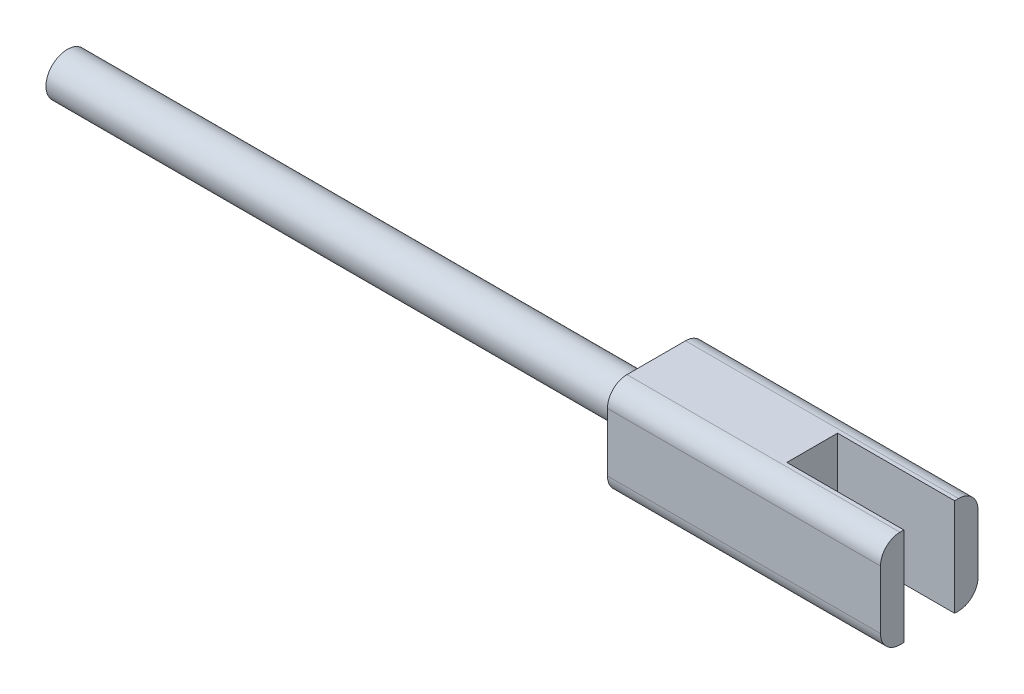
from build123d import *

# Parameters (mm, degrees)
SKETCH1_R               = 1.09
BOSS_EXTRUDE1_DEPTH     = 32.2
BOSS_EXTRUDE2_DEPTH     = 14
CUT_EXTRUDE1_DEPTH      = 45.341177251
CUT_EXTRUDE1_DEPTH_BACK = 45.341177251
SKETCH3_W               = 7
SKETCH3_H               = 2.6


with BuildPart() as part:
    # Sketch1 → Boss-Extrude1 (new body)
    with BuildSketch(Plane(origin=(0, 0, 0), x_dir=(0, 0, -1), z_dir=(1, 0, 0))):
        Circle(SKETCH1_R)
    extrude(amount=BOSS_EXTRUDE1_DEPTH)

    # Sketch2 → Boss-Extrude2 (add)
    with BuildSketch(Plane(origin=(30.2, 0, 0), x_dir=(0, 0, -1), z_dir=(1, 0, 0))):
        with BuildLine():
            Line((-1.5, -2.5), (1.5, -2.5))
            ThreePointArc((1.5, -2.5), (2.207106781, -2.207106781), (2.5, -1.5))
            Line((2.5, -1.5), (2.5, 1.5))
            ThreePointArc((2.5, 1.5), (2.207106781, 2.207106781), (1.5, 2.5))
            Line((1.5, 2.5), (-1.5, 2.5))
            ThreePointArc((-1.5, 2.5), (-2.207106781, 2.207106781), (-2.5, 1.5))
            Line((-2.5, 1.5), (-2.5, -1.5))
            ThreePointArc((-2.5, -1.5), (-2.207106781, -2.207106781), (-1.5, -2.5))
        make_face()
    extrude(amount=BOSS_EXTRUDE2_DEPTH)

    # Sketch3 → Cut-Extrude1 (cut, two sides: drawn at the far end of the back side and taken through both)
    with BuildSketch(Plane(origin=(0, 0, 0), x_dir=(1, 0, 0), z_dir=(0, 1, 0)).offset(-CUT_EXTRUDE1_DEPTH_BACK)):
        with Locations((41.7, 0)):
            Rectangle(SKETCH3_W, SKETCH3_H)
    extrude(amount=CUT_EXTRUDE1_DEPTH + CUT_EXTRUDE1_DEPTH_BACK, mode=Mode.SUBTRACT)


solid = part.part
